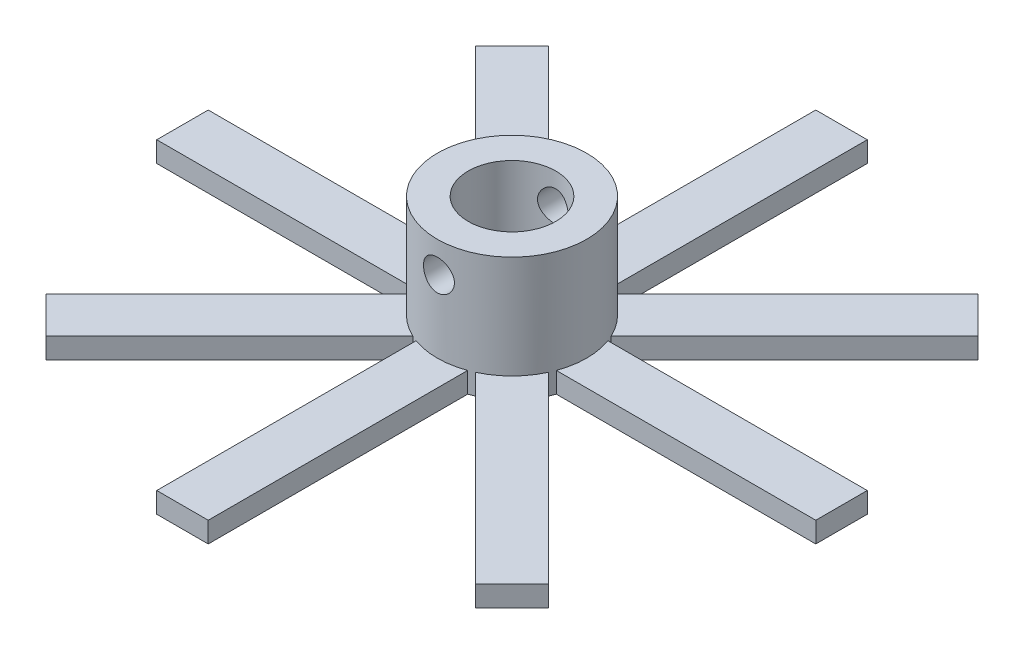
from build123d import *

# Parameters (mm, degrees)
SKETCH1_R               = 4.25
BOSS_EXTRUDE1_DEPTH     = 2
SKETCH1_3_R             = 7.25
SKETCH1_3_R_2           = 4.25
BOSS_EXTRUDE2_DEPTH     = 12
CUT_EXTRUDE1_DEPTH      = 47.818799643
CUT_EXTRUDE1_DEPTH_BACK = 47.818799643
SKETCH2_R               = 1.5


with BuildPart() as part:
    # Sketch1 → Boss-Extrude1 (new body)
    with BuildSketch(Plane(origin=(0, 0, 0), x_dir=(1, 0, 0), z_dir=(0, 1, 0))):
        with BuildLine():
            ThreePointArc((-2.5, 6.805328794), (-2.774454885, 6.698126611), (-3.044327186, 6.579861092))
            Line((-3.044327186, 6.579861092), (-20.859650045, 24.395183951))
            Line((-20.859650045, 24.395183951), (-24.395183951, 20.859650045))
            Line((-24.395183951, 20.859650045), (-6.579861092, 3.044327186))
            ThreePointArc((-6.579861092, 3.044327186), (-6.698126611, 2.774454885), (-6.805328794, 2.5))
            Line((-6.805328794, 2.5), (-32, 2.5))
            Line((-32, 2.5), (-32, -2.5))
            Line((-32, -2.5), (-6.805328794, -2.5))
            ThreePointArc((-6.805328794, -2.5), (-6.698126611, -2.774454885), (-6.579861092, -3.044327186))
            Line((-6.579861092, -3.044327186), (-24.395183951, -20.859650045))
            Line((-24.395183951, -20.859650045), (-20.859650045, -24.395183951))
            Line((-20.859650045, -24.395183951), (-3.044327186, -6.579861092))
            ThreePointArc((-3.044327186, -6.579861092), (-2.774454885, -6.698126611), (-2.5, -6.805328794))
            Line((-2.5, -6.805328794), (-2.5, -32))
            Line((-2.5, -32), (2.5, -32))
            Line((2.5, -32), (2.5, -6.805328794))
            ThreePointArc((2.5, -6.805328794), (2.774454885, -6.698126611), (3.044327186, -6.579861092))
            Line((3.044327186, -6.579861092), (20.859650045, -24.395183951))
            Line((20.859650045, -24.395183951), (24.395183951, -20.859650045))
            Line((24.395183951, -20.859650045), (6.579861092, -3.044327186))
            ThreePointArc((6.579861092, -3.044327186), (6.698126611, -2.774454885), (6.805328794, -2.5))
            Line((6.805328794, -2.5), (32, -2.5))
            Line((32, -2.5), (32, 2.5))
            Line((32, 2.5), (6.805328794, 2.5))
            ThreePointArc((6.805328794, 2.5), (6.698126611, 2.774454885), (6.579861092, 3.044327186))
            Line((6.579861092, 3.044327186), (24.395183951, 20.859650045))
            Line((24.395183951, 20.859650045), (20.859650045, 24.395183951))
            Line((20.859650045, 24.395183951), (3.044327186, 6.579861092))
            ThreePointArc((3.044327186, 6.579861092), (2.774454885, 6.698126611), (2.5, 6.805328794))
            Line((2.5, 6.805328794), (2.5, 32))
            Line((2.5, 32), (-2.5, 32))
            Line((-2.5, 32), (-2.5, 6.805328794))
        make_face()
        Circle(SKETCH1_R, mode=Mode.SUBTRACT)
    extrude(amount=BOSS_EXTRUDE1_DEPTH)

    # Sketch1<3> → Boss-Extrude2 (add)
    with BuildSketch(Plane(origin=(0, 0, 0), x_dir=(1, 0, 0), z_dir=(0, 1, 0))):
        Circle(SKETCH1_3_R)
        Circle(SKETCH1_3_R_2, mode=Mode.SUBTRACT)
    extrude(amount=BOSS_EXTRUDE2_DEPTH)

    # Sketch2 → Cut-Extrude1 (cut, two sides: drawn at the far end of the back side and taken through both)
    with BuildSketch(Plane.XY.offset(-CUT_EXTRUDE1_DEPTH_BACK)):
        with Locations((0, 9)):
            Circle(SKETCH2_R)
    extrude(amount=CUT_EXTRUDE1_DEPTH + CUT_EXTRUDE1_DEPTH_BACK, mode=Mode.SUBTRACT)


solid = part.part
